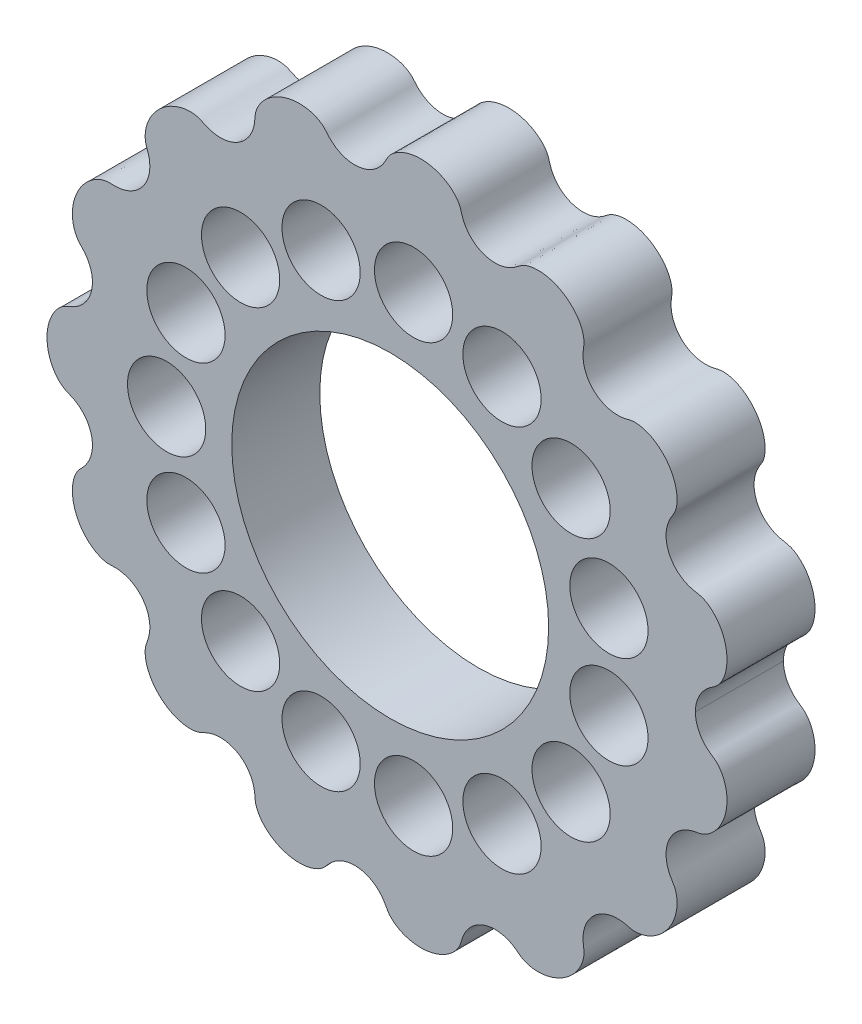
from build123d import *

# Parameters (mm, degrees)
SKETCH2_R           = 9
SKETCH2_R_2         = 2.2225
BOSS_EXTRUDE1_DEPTH = 5


with BuildPart() as part:
    # Sketch2 → Boss-Extrude1 (new body)
    with BuildSketch(Plane.XY):
        with BuildLine():
            add(Edge.make_bspline(
                [(17.3355, 0), (17.3355, 0.021985663), (17.336391897, 0.066076316), (17.340405393, 0.148217555), (17.351092206, 0.255798828), (17.371110601, 0.380777662), (17.405716496, 0.529150988), (17.460844505, 0.699304431), (17.543120572, 0.883499994), (17.643464039, 1.058481389), (17.760486653, 1.221373942), (17.886844261, 1.364805071), (18.018763299, 1.489289539), (18.152045744, 1.596780669), (18.284027236, 1.688706119), (18.406844701, 1.767733403), (18.510079756, 1.848413591), (18.611350279, 1.94688903), (18.710251596, 2.064872157), (18.811911065, 2.215063218), (18.978777344, 2.531772659), (19.128410379, 3.022160862), (19.169076849, 3.677786135), (19.019654492, 4.361622225), (18.765789489, 4.895038236), (18.502874974, 5.249869467), (18.290844595, 5.466728939), (18.09091464, 5.624987653), (17.935968791, 5.7217949), (17.799640771, 5.788676092), (17.672482082, 5.836531911), (17.549901004, 5.868776152), (17.409837082, 5.891114002), (17.255727062, 5.919232453), (17.095172063, 5.959977434), (16.929676238, 6.015314846), (16.71819701, 6.107158679), (16.469055307, 6.255168605), (16.208212785, 6.474465951), (15.960556505, 6.785120766), (15.776970044, 7.148853554), (15.672274802, 7.547857283), (15.656502948, 7.913470892), (15.697982697, 8.222824037), (15.764069045, 8.460903217), (15.830200748, 8.633812798), (15.905665033, 8.790843458), (15.986492139, 8.932646661), (16.067752096, 9.056592578), (16.135325597, 9.171438962), (16.194533637, 9.302646718), (16.241835332, 9.450308712), (16.278211388, 9.627285357), (16.310719362, 9.987437643), (16.256326167, 10.505015526), (16.025510377, 11.147118643), (15.590607033, 11.738199399), (15.109390316, 12.139114314), (14.694321793, 12.357293799), (14.400501357, 12.46055604), (14.143429103, 12.513541054), (13.957404634, 12.529575778), (13.795522627, 12.524013871), (13.64595889, 12.499121111), (13.511034976, 12.464011056), (13.361391924, 12.42663487), (13.194365548, 12.398081177), (13.015439441, 12.380960827), (12.825312006, 12.379688448), (12.573828134, 12.402593312), (12.265545154, 12.475397892), (11.935468979, 12.619331881), (11.606843636, 12.85408378), (11.339438412, 13.142936436), (11.139863678, 13.46774114), (11.021000802, 13.786609177), (10.963868827, 14.078107769), (10.949325947, 14.316746617), (10.954737391, 14.499641184), (10.971865927, 14.664858221), (10.995250384, 14.812499772), (11.013780363, 14.970670965), (11.007910868, 15.139861598), (10.977700353, 15.3255082), (10.921263363, 15.524608317), (10.825967325, 15.760061968), (10.679341601, 16.023220071), (10.420198981, 16.370717951), (10.002176568, 16.754548343), (9.508776209, 17.039413173), (8.967358133, 17.209516006), (8.536844831, 17.260191158), (8.235630366, 17.255593708), (7.984073504, 17.220395672), (7.78342925, 17.169721482), (7.607549319, 17.103061253), (7.458091185, 17.023549069), (7.330375903, 16.92841604), (7.214206798, 16.83434373), (7.079688915, 16.736901465), (6.924003296, 16.640767733), (6.710064551, 16.534042813), (6.429053378, 16.437771258), (6.093474119, 16.38127551), (5.712397627, 16.391709948), (5.328541278, 16.478863337), (4.960927498, 16.646085283), (4.671238919, 16.859972641), (4.454046813, 17.090551244), (4.308468683, 17.296890233), (4.214506879, 17.462181611), (4.139870483, 17.62569634), (4.081085519, 17.784622272), (4.038632719, 17.932905048), (4.001576962, 18.067307613), (3.948352856, 18.209279989), (3.872228605, 18.352254874), (3.765329892, 18.505339427), (3.590907397, 18.701478023), (3.354569454, 18.904302864), (2.958086216, 19.154673007), (2.370275357, 19.37096145), (1.640932735, 19.452058417), (0.969447228, 19.330899197), (0.494015036, 19.119216144), (0.198367994, 18.910987269), (0.063289751, 18.790996357), (-0.040938438, 18.676200891), (-0.124963669, 18.559321346), (-0.190636804, 18.443377786), (-0.257347139, 18.31103164), (-0.339738762, 18.170131711), (-0.43799916, 18.026262394), (-0.554677398, 17.882535869), (-0.727816842, 17.706263822), (-0.97498465, 17.515664734), (-1.29950125, 17.346516756), (-1.697396237, 17.23768363), (-2.104191302, 17.214807775), (-2.497054403, 17.273956997), (-2.817392738, 17.390204575), (-3.070143945, 17.531962656), (-3.255422652, 17.669187123), (-3.386094166, 17.784842006), (-3.501657858, 17.903514223), (-3.603064171, 18.022918187), (-3.692441219, 18.133048189), (-3.781656132, 18.223084388), (-3.886680233, 18.309279051), (-4.012763029, 18.393902396), (-4.174078601, 18.479684773), (-4.411089758, 18.573701849), (-4.704928378, 18.64889222), (-5.143646968, 18.699173675), (-5.732586798, 18.652307905), (-6.302314865, 18.470756724), (-6.817388279, 18.16270333), (-7.154850449, 17.854003393), (-7.350652501, 17.616613418), (-7.487619341, 17.399131648), (-7.566912767, 17.235985462), (-7.619614489, 17.091347733), (-7.654267262, 16.954405986), (-7.672520845, 16.824661668), (-7.679549779, 16.678785749), (-7.69317517, 16.51852081), (-7.719604886, 16.349358145), (-7.761493774, 16.172850973), (-7.838360905, 15.944476505), (-7.972620328, 15.671900424), (-8.182487907, 15.383427737), (-8.486003723, 15.109675307), (-8.842360798, 14.903932454), (-9.231195264, 14.777956262), (-9.585953729, 14.740441951), (-9.889141251, 14.76045792), (-10.125352907, 14.808076266), (-10.299157046, 14.860053011), (-10.45887107, 14.921745538), (-10.604477273, 14.990078073), (-10.734323993, 15.056928797), (-10.855812659, 15.105992889), (-10.991734078, 15.144453581), (-11.143344886, 15.171131416), (-11.32428034, 15.184034388), (-11.581108499, 15.174158509), (-11.884595273, 15.123283945), (-12.320668346, 14.985383102), (-12.844987118, 14.693343138), (-13.287079086, 14.290719748), (-13.622135948, 13.80411578), (-13.797950226, 13.399033608), (-13.879752765, 13.106966714), (-13.916837167, 12.854700492), (-13.923205235, 12.67210592), (-13.912960667, 12.520603343), (-13.890825949, 12.386552472), (-13.85745977, 12.264271992), (-13.806772915, 12.131804197), (-13.754069205, 11.984281772), (-13.709077896, 11.824864571), (-13.674253587, 11.653872278), (-13.648053066, 11.424803977), (-13.65166257, 11.135035971), (-13.711158382, 10.799491046), (-13.856365204, 10.42968701), (-14.079573808, 10.088830076), (-14.372773552, 9.798659473), (-14.681518299, 9.602193842), (-14.970165855, 9.483439785), (-15.209391648, 9.421632652), (-15.392201588, 9.392449596), (-15.565926271, 9.379288254), (-15.729145, 9.37838498), (-15.877115292, 9.386785208), (-16.010361928, 9.387882385), (-16.1535952, 9.373554171), (-16.305125078, 9.340687653), (-16.476579391, 9.2837019), (-16.80473438, 9.131778526), (-17.225773436, 8.825883616), (-17.666443043, 8.30493987), (-17.960882479, 7.632761929), (-18.067476404, 7.015558872), (-18.048891445, 6.547008794), (-17.991408385, 6.240922494), (-17.908759632, 5.99179749), (-17.829631782, 5.82268111), (-17.74387946, 5.685260808), (-17.660973631, 5.584549598), (-17.594321233, 5.51410487), (-17.530762206, 5.449224517), (-17.472439107, 5.387900059), (-17.401938622, 5.30904216), (-17.321911817, 5.210403864), (-17.229963503, 5.081202456), (-17.133773764, 4.91720915), (-17.027878962, 4.687953666), (-16.936781456, 4.38457753), (-16.896398102, 4.026751676), (-16.935383991, 3.624780538), (-17.051836613, 3.248772903), (-17.233337405, 2.913534787), (-17.450054422, 2.651161824), (-17.673933235, 2.455935197), (-17.873329324, 2.324021029), (-18.034426272, 2.237260323), (-18.186072719, 2.169485475), (-18.325626378, 2.115916394), (-18.471871275, 2.05287773), (-18.615460843, 1.963200552), (-18.761128227, 1.844211381), (-18.905339356, 1.695790878), (-19.061592575, 1.495524004), (-19.19203374, 1.277396747), (-19.294403423, 1.055193553), (-19.371912403, 0.83343068), (-19.421414486, 0.652174653), (-19.45385934, 0.490143806), (-19.473927729, 0.353496972), (-19.485501057, 0.233793415), (-19.491672035, 0.132635459), (-19.493985825, 0.060761082), (-19.4945, 0.020255715), (-19.4945, 0)],
                knots=[0.068176397, 0.068176397, 0.068176397, 0.068176397, 0.068176397, 0.069432025, 0.070687653, 0.071943281, 0.073198909, 0.075719617, 0.078240324, 0.080693931, 0.083147537, 0.085630319, 0.088113101, 0.090094726, 0.092076352, 0.094057977, 0.096039602, 0.097282303, 0.098525004, 0.101010405, 0.103607323, 0.106204241, 0.116126671, 0.126049014, 0.135532674, 0.140274394, 0.145016115, 0.147725044, 0.150433974, 0.152812728, 0.154002106, 0.155191483, 0.157121549, 0.159051614, 0.16098168, 0.162911746, 0.165276347, 0.167640948, 0.172326587, 0.177141126, 0.181960521, 0.187087003, 0.1922594, 0.197312278, 0.199857806, 0.202403334, 0.204413296, 0.206423258, 0.208433221, 0.210443183, 0.211712467, 0.21298175, 0.215520317, 0.218060274, 0.220600231, 0.23076075, 0.240920318, 0.2511971, 0.256273218, 0.261349336, 0.263919885, 0.266490434, 0.269181478, 0.270526999, 0.271872521, 0.273957641, 0.276042761, 0.278127881, 0.280213001, 0.282805647, 0.285398294, 0.290548723, 0.295753606, 0.300412806, 0.305158439, 0.309821071, 0.314418508, 0.317079892, 0.319741277, 0.321581872, 0.323422467, 0.325263062, 0.327103656, 0.329418624, 0.331733592, 0.334508003, 0.337282413, 0.341909651, 0.346536889, 0.355791519, 0.365046149, 0.369673386, 0.374300624, 0.377075035, 0.379849445, 0.382164413, 0.384479381, 0.386319976, 0.388160571, 0.390001166, 0.391841761, 0.394503145, 0.39716453, 0.401761966, 0.406424598, 0.411170231, 0.415829431, 0.421034315, 0.426184744, 0.42877739, 0.431370037, 0.433455157, 0.435540277, 0.437625396, 0.439710516, 0.441056038, 0.44240156, 0.445092604, 0.447663152, 0.450233701, 0.455309819, 0.460385938, 0.47066272, 0.480822288, 0.490982806, 0.493522763, 0.49606272, 0.498601287, 0.499870571, 0.501139854, 0.503149817, 0.505159779, 0.507169742, 0.509179704, 0.511725232, 0.51427076, 0.519323638, 0.524496034, 0.529622516, 0.534441911, 0.539256451, 0.543942089, 0.546306691, 0.548671292, 0.550601358, 0.552531423, 0.554461489, 0.556391555, 0.557580932, 0.558770309, 0.561149064, 0.563857993, 0.566566923, 0.571308643, 0.576050364, 0.585534024, 0.595456366, 0.600417581, 0.605378797, 0.607975715, 0.610572633, 0.613058034, 0.614300735, 0.615543435, 0.617525061, 0.619506686, 0.621488311, 0.623469936, 0.625952718, 0.6284355, 0.633342713, 0.638384128, 0.643406641, 0.648429154, 0.653470569, 0.658377782, 0.660860564, 0.663343346, 0.665324971, 0.667306596, 0.669288221, 0.671269847, 0.672512547, 0.673755248, 0.676240649, 0.678837567, 0.681434485, 0.686395701, 0.691356916, 0.701279258, 0.710762918, 0.715504639, 0.720246359, 0.722955289, 0.725664218, 0.728042973, 0.72923235, 0.730421727, 0.732351793, 0.734281859, 0.736211924, 0.73814199, 0.740506591, 0.742871193, 0.747556831, 0.752371371, 0.757190766, 0.762317247, 0.767489644, 0.772542522, 0.77508805, 0.777633578, 0.77964354, 0.781653503, 0.783663465, 0.785673428, 0.786942711, 0.788211995, 0.790750562, 0.793290519, 0.795830476, 0.805990994, 0.816150562, 0.826427344, 0.831503463, 0.836579581, 0.83915013, 0.841720678, 0.844411722, 0.845757244, 0.847102766, 0.848145326, 0.849187886, 0.850230445, 0.851273005, 0.853358125, 0.855443245, 0.858035892, 0.860628538, 0.865778967, 0.870983851, 0.875643051, 0.880388684, 0.885051316, 0.889648752, 0.892310137, 0.894971521, 0.896812116, 0.898652711, 0.900493306, 0.902333901, 0.904648869, 0.906963837, 0.909738247, 0.912512658, 0.917139896, 0.919453515, 0.921767133, 0.924080791, 0.926394448, 0.927551277, 0.928708106, 0.929864934, 0.931021763, 0.931021763, 0.931021763, 0.931021763, 0.931021763], degree=4))
            add(Edge.make_bspline(
                [(17.3355, 0), (17.3355, -0.021985664), (17.336391897, -0.066076316), (17.340405393, -0.148217555), (17.351092206, -0.255798828), (17.371110601, -0.380777662), (17.405716496, -0.529150988), (17.460844505, -0.699304431), (17.543120572, -0.883499995), (17.643464039, -1.058481389), (17.760486653, -1.221373942), (17.886844261, -1.364805072), (18.018763299, -1.489289539), (18.152045744, -1.59678067), (18.284027236, -1.688706119), (18.406844701, -1.767733404), (18.510079756, -1.848413591), (18.611350279, -1.94688903), (18.710251596, -2.064872157), (18.811911065, -2.215063218), (18.978777344, -2.531772659), (19.128410379, -3.022160862), (19.169076849, -3.677786135), (19.019654492, -4.361622225), (18.765789489, -4.895038237), (18.502874974, -5.249869467), (18.290844595, -5.466728939), (18.09091464, -5.624987653), (17.935968791, -5.7217949), (17.799640771, -5.788676092), (17.672482082, -5.836531911), (17.549901004, -5.868776152), (17.409837082, -5.891114002), (17.255727062, -5.919232453), (17.095172063, -5.959977434), (16.929676238, -6.015314846), (16.71819701, -6.107158679), (16.469055307, -6.255168605), (16.208212785, -6.474465951), (15.960556505, -6.785120766), (15.776970044, -7.148853554), (15.672274802, -7.547857283), (15.656502948, -7.913470893), (15.697982697, -8.222824037), (15.764069045, -8.460903217), (15.830200747, -8.633812798), (15.905665033, -8.790843458), (15.986492139, -8.932646661), (16.067752096, -9.056592578), (16.135325597, -9.171438962), (16.194533637, -9.302646719), (16.241835332, -9.450308712), (16.278211388, -9.627285357), (16.310719362, -9.987437644), (16.256326167, -10.505015526), (16.025510377, -11.147118643), (15.590607033, -11.738199399), (15.109390316, -12.139114314), (14.694321793, -12.357293799), (14.400501357, -12.46055604), (14.143429103, -12.513541054), (13.957404634, -12.529575778), (13.795522627, -12.524013871), (13.645958889, -12.499121111), (13.511034976, -12.464011056), (13.361391924, -12.42663487), (13.194365548, -12.398081177), (13.015439441, -12.380960828), (12.825312006, -12.379688448), (12.573828134, -12.402593312), (12.265545154, -12.475397892), (11.935468979, -12.619331881), (11.606843636, -12.854083781), (11.339438412, -13.142936436), (11.139863678, -13.46774114), (11.021000801, -13.786609177), (10.963868827, -14.078107769), (10.949325947, -14.316746617), (10.954737391, -14.499641184), (10.971865927, -14.664858221), (10.995250384, -14.812499772), (11.013780363, -14.970670965), (11.007910868, -15.139861598), (10.977700353, -15.3255082), (10.921263363, -15.524608317), (10.825967324, -15.760061968), (10.679341601, -16.023220072), (10.420198981, -16.370717952), (10.002176568, -16.754548343), (9.508776209, -17.039413173), (8.967358133, -17.209516006), (8.536844831, -17.260191158), (8.235630366, -17.255593708), (7.984073504, -17.220395673), (7.78342925, -17.169721482), (7.607549319, -17.103061253), (7.458091185, -17.023549069), (7.330375903, -16.92841604), (7.214206798, -16.83434373), (7.079688915, -16.736901465), (6.924003296, -16.640767733), (6.710064551, -16.534042813), (6.429053378, -16.437771258), (6.093474119, -16.38127551), (5.712397627, -16.391709948), (5.328541277, -16.478863337), (4.960927497, -16.646085283), (4.671238919, -16.859972641), (4.454046813, -17.090551244), (4.308468683, -17.296890233), (4.214506879, -17.462181611), (4.139870483, -17.62569634), (4.081085518, -17.784622272), (4.038632719, -17.932905048), (4.001576961, -18.067307613), (3.948352855, -18.209279989), (3.872228605, -18.352254874), (3.765329892, -18.505339427), (3.590907397, -18.701478023), (3.354569454, -18.904302864), (2.958086216, -19.154673007), (2.370275357, -19.370961451), (1.640932735, -19.452058417), (0.969447228, -19.330899197), (0.494015036, -19.119216144), (0.198367994, -18.910987269), (0.063289751, -18.790996357), (-0.040938439, -18.676200891), (-0.124963669, -18.559321346), (-0.190636804, -18.443377786), (-0.257347139, -18.31103164), (-0.339738762, -18.170131711), (-0.43799916, -18.026262394), (-0.554677398, -17.882535869), (-0.727816842, -17.706263822), (-0.97498465, -17.515664734), (-1.29950125, -17.346516756), (-1.697396237, -17.23768363), (-2.104191302, -17.214807775), (-2.497054403, -17.273956997), (-2.817392738, -17.390204575), (-3.070143945, -17.531962656), (-3.255422652, -17.669187123), (-3.386094167, -17.784842006), (-3.501657859, -17.903514223), (-3.603064171, -18.022918187), (-3.692441219, -18.133048189), (-3.781656132, -18.223084388), (-3.886680233, -18.309279051), (-4.012763029, -18.393902396), (-4.174078601, -18.479684773), (-4.411089758, -18.573701849), (-4.704928378, -18.64889222), (-5.143646968, -18.699173675), (-5.732586798, -18.652307905), (-6.302314865, -18.470756724), (-6.817388279, -18.16270333), (-7.154850449, -17.854003393), (-7.350652501, -17.616613418), (-7.487619342, -17.399131648), (-7.566912767, -17.235985462), (-7.619614489, -17.091347733), (-7.654267262, -16.954405986), (-7.672520845, -16.824661668), (-7.67954978, -16.678785749), (-7.69317517, -16.51852081), (-7.719604886, -16.349358145), (-7.761493774, -16.172850973), (-7.838360905, -15.944476505), (-7.972620328, -15.671900424), (-8.182487908, -15.383427737), (-8.486003723, -15.109675307), (-8.842360798, -14.903932454), (-9.231195264, -14.777956262), (-9.585953729, -14.740441951), (-9.889141251, -14.76045792), (-10.125352908, -14.808076266), (-10.299157046, -14.860053011), (-10.45887107, -14.921745538), (-10.604477274, -14.990078073), (-10.734323993, -15.056928797), (-10.855812659, -15.105992889), (-10.991734078, -15.144453581), (-11.143344886, -15.171131416), (-11.32428034, -15.184034387), (-11.581108499, -15.174158509), (-11.884595273, -15.123283945), (-12.320668346, -14.985383102), (-12.844987118, -14.693343138), (-13.287079086, -14.290719748), (-13.622135948, -13.80411578), (-13.797950226, -13.399033608), (-13.879752765, -13.106966713), (-13.916837167, -12.854700492), (-13.923205235, -12.67210592), (-13.912960667, -12.520603343), (-13.890825949, -12.386552472), (-13.85745977, -12.264271992), (-13.806772915, -12.131804197), (-13.754069205, -11.984281772), (-13.709077896, -11.82486457), (-13.674253587, -11.653872278), (-13.648053066, -11.424803977), (-13.65166257, -11.135035971), (-13.711158382, -10.799491046), (-13.856365204, -10.42968701), (-14.079573808, -10.088830076), (-14.372773552, -9.798659473), (-14.681518299, -9.602193842), (-14.970165855, -9.483439785), (-15.209391648, -9.421632652), (-15.392201588, -9.392449596), (-15.565926271, -9.379288254), (-15.729145, -9.37838498), (-15.877115292, -9.386785208), (-16.010361928, -9.387882385), (-16.1535952, -9.373554171), (-16.305125078, -9.340687653), (-16.476579391, -9.2837019), (-16.80473438, -9.131778526), (-17.225773436, -8.825883616), (-17.666443043, -8.30493987), (-17.960882479, -7.632761929), (-18.067476404, -7.015558872), (-18.048891445, -6.547008793), (-17.991408385, -6.240922494), (-17.908759632, -5.99179749), (-17.829631782, -5.822681109), (-17.74387946, -5.685260808), (-17.660973631, -5.584549598), (-17.594321233, -5.51410487), (-17.530762206, -5.449224517), (-17.472439107, -5.387900059), (-17.401938622, -5.30904216), (-17.321911817, -5.210403864), (-17.229963503, -5.081202456), (-17.133773764, -4.91720915), (-17.027878962, -4.687953666), (-16.936781456, -4.38457753), (-16.896398102, -4.026751676), (-16.935383991, -3.624780537), (-17.051836613, -3.248772903), (-17.233337405, -2.913534787), (-17.450054422, -2.651161824), (-17.673933235, -2.455935197), (-17.873329324, -2.324021029), (-18.034426272, -2.237260323), (-18.186072719, -2.169485475), (-18.325626378, -2.115916394), (-18.471871275, -2.05287773), (-18.615460843, -1.963200552), (-18.761128227, -1.844211381), (-18.905339356, -1.695790878), (-19.061592575, -1.495524004), (-19.19203374, -1.277396747), (-19.294403423, -1.055193553), (-19.371912403, -0.83343068), (-19.421414486, -0.652174653), (-19.45385934, -0.490143806), (-19.473927729, -0.353496971), (-19.485501057, -0.233793415), (-19.491672035, -0.132635459), (-19.493985825, -0.060761082), (-19.4945, -0.020255714), (-19.4945, 0)],
                knots=[0.068176397, 0.068176397, 0.068176397, 0.068176397, 0.068176397, 0.069432025, 0.070687653, 0.071943281, 0.073198909, 0.075719617, 0.078240324, 0.080693931, 0.083147537, 0.085630319, 0.088113101, 0.090094726, 0.092076352, 0.094057977, 0.096039602, 0.097282303, 0.098525004, 0.101010405, 0.103607323, 0.106204241, 0.116126671, 0.126049014, 0.135532674, 0.140274394, 0.145016115, 0.147725044, 0.150433974, 0.152812728, 0.154002106, 0.155191483, 0.157121549, 0.159051614, 0.16098168, 0.162911746, 0.165276347, 0.167640948, 0.172326587, 0.177141126, 0.181960521, 0.187087003, 0.1922594, 0.197312278, 0.199857806, 0.202403334, 0.204413296, 0.206423258, 0.208433221, 0.210443183, 0.211712467, 0.21298175, 0.215520317, 0.218060274, 0.220600231, 0.23076075, 0.240920318, 0.2511971, 0.256273218, 0.261349336, 0.263919885, 0.266490434, 0.269181478, 0.270526999, 0.271872521, 0.273957641, 0.276042761, 0.278127881, 0.280213001, 0.282805647, 0.285398294, 0.290548723, 0.295753606, 0.300412806, 0.305158439, 0.309821071, 0.314418508, 0.317079892, 0.319741277, 0.321581872, 0.323422467, 0.325263062, 0.327103656, 0.329418624, 0.331733592, 0.334508003, 0.337282413, 0.341909651, 0.346536889, 0.355791519, 0.365046149, 0.369673386, 0.374300624, 0.377075035, 0.379849445, 0.382164413, 0.384479381, 0.386319976, 0.388160571, 0.390001166, 0.391841761, 0.394503145, 0.39716453, 0.401761966, 0.406424598, 0.411170231, 0.415829431, 0.421034315, 0.426184744, 0.42877739, 0.431370037, 0.433455157, 0.435540277, 0.437625396, 0.439710516, 0.441056038, 0.44240156, 0.445092604, 0.447663152, 0.450233701, 0.455309819, 0.460385938, 0.47066272, 0.480822288, 0.490982806, 0.493522763, 0.49606272, 0.498601287, 0.499870571, 0.501139854, 0.503149817, 0.505159779, 0.507169742, 0.509179704, 0.511725232, 0.51427076, 0.519323638, 0.524496034, 0.529622516, 0.534441911, 0.539256451, 0.543942089, 0.546306691, 0.548671292, 0.550601358, 0.552531423, 0.554461489, 0.556391555, 0.557580932, 0.558770309, 0.561149064, 0.563857993, 0.566566923, 0.571308643, 0.576050364, 0.585534024, 0.595456366, 0.600417581, 0.605378797, 0.607975715, 0.610572633, 0.613058034, 0.614300735, 0.615543435, 0.617525061, 0.619506686, 0.621488311, 0.623469936, 0.625952718, 0.6284355, 0.633342713, 0.638384128, 0.643406641, 0.648429154, 0.653470569, 0.658377782, 0.660860564, 0.663343346, 0.665324971, 0.667306596, 0.669288221, 0.671269847, 0.672512547, 0.673755248, 0.676240649, 0.678837567, 0.681434485, 0.686395701, 0.691356916, 0.701279258, 0.710762918, 0.715504639, 0.720246359, 0.722955289, 0.725664218, 0.728042973, 0.72923235, 0.730421727, 0.732351793, 0.734281859, 0.736211924, 0.73814199, 0.740506591, 0.742871193, 0.747556831, 0.752371371, 0.757190766, 0.762317247, 0.767489644, 0.772542522, 0.77508805, 0.777633578, 0.77964354, 0.781653503, 0.783663465, 0.785673428, 0.786942711, 0.788211995, 0.790750562, 0.793290519, 0.795830476, 0.805990994, 0.816150562, 0.826427344, 0.831503463, 0.836579581, 0.83915013, 0.841720678, 0.844411722, 0.845757244, 0.847102766, 0.848145326, 0.849187886, 0.850230445, 0.851273005, 0.853358125, 0.855443245, 0.858035892, 0.860628538, 0.865778967, 0.870983851, 0.875643051, 0.880388684, 0.885051316, 0.889648752, 0.892310137, 0.894971521, 0.896812116, 0.898652711, 0.900493306, 0.902333901, 0.904648869, 0.906963837, 0.909738247, 0.912512658, 0.917139896, 0.919453515, 0.921767133, 0.924080791, 0.926394448, 0.927551277, 0.928708106, 0.929864934, 0.931021763, 0.931021763, 0.931021763, 0.931021763, 0.931021763], degree=4))
        make_face()
        Circle(SKETCH2_R, mode=Mode.SUBTRACT)
        with Locations((-12.7, 0)):
            Circle(SKETCH2_R_2, mode=Mode.SUBTRACT)
        with Locations((-11.602027312, 5.165555367)):
            Circle(SKETCH2_R_2, mode=Mode.SUBTRACT)
        with Locations((-8.497958701, 9.437939284)):
            Circle(SKETCH2_R_2, mode=Mode.SUBTRACT)
        with Locations((-3.924515829, 12.078417757)):
            Circle(SKETCH2_R_2, mode=Mode.SUBTRACT)
        with Locations((1.327511483, 12.630428071)):
            Circle(SKETCH2_R_2, mode=Mode.SUBTRACT)
        with Locations((6.35, 10.998522628)):
            Circle(SKETCH2_R_2, mode=Mode.SUBTRACT)
        with Locations((10.274515829, 7.464872704)):
            Circle(SKETCH2_R_2, mode=Mode.SUBTRACT)
        with Locations((12.422474529, 2.640478473)):
            Circle(SKETCH2_R_2, mode=Mode.SUBTRACT)
        with Locations((12.422474529, -2.640478473)):
            Circle(SKETCH2_R_2, mode=Mode.SUBTRACT)
        with Locations((10.274515829, -7.464872704)):
            Circle(SKETCH2_R_2, mode=Mode.SUBTRACT)
        with Locations((6.35, -10.998522628)):
            Circle(SKETCH2_R_2, mode=Mode.SUBTRACT)
        with Locations((1.327511483, -12.630428071)):
            Circle(SKETCH2_R_2, mode=Mode.SUBTRACT)
        with Locations((-3.924515829, -12.078417757)):
            Circle(SKETCH2_R_2, mode=Mode.SUBTRACT)
        with Locations((-8.497958701, -9.437939284)):
            Circle(SKETCH2_R_2, mode=Mode.SUBTRACT)
        with Locations((-11.602027312, -5.165555367)):
            Circle(SKETCH2_R_2, mode=Mode.SUBTRACT)
    extrude(amount=BOSS_EXTRUDE1_DEPTH)


solid = part.part
